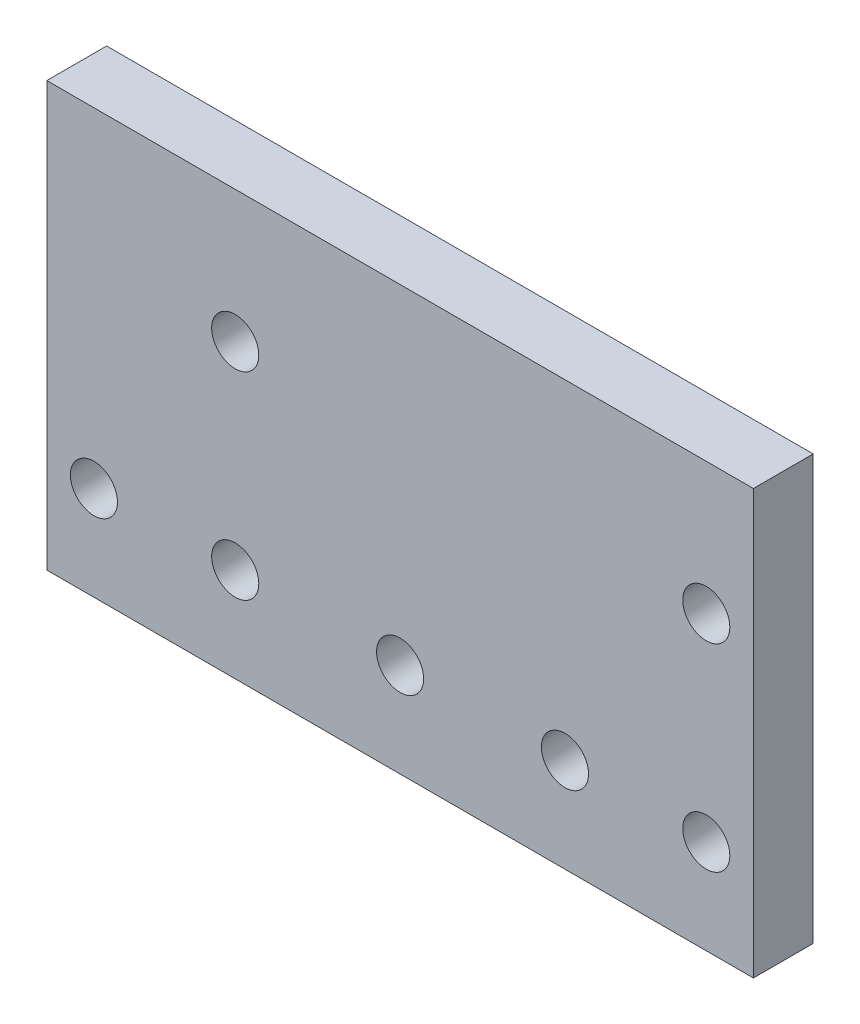
from build123d import *

# Parameters (mm, degrees)
SKETCH1_W           = 75
SKETCH1_H           = 45
SKETCH1_R           = 2.5
BOSS_EXTRUDE1_DEPTH = 6.35


with BuildPart() as part:
    # Sketch1 → Boss-Extrude1 (new body)
    with BuildSketch(Plane.XY):
        with Locations((37.5, 22.5)):
            Rectangle(SKETCH1_W, SKETCH1_H)
        with Locations((20, 31)):
            Circle(SKETCH1_R, mode=Mode.SUBTRACT)
        with Locations((70, 31)):
            Circle(SKETCH1_R, mode=Mode.SUBTRACT)
        with Locations((5, 10)):
            Circle(SKETCH1_R, mode=Mode.SUBTRACT)
        with Locations((20, 10)):
            Circle(SKETCH1_R, mode=Mode.SUBTRACT)
        with Locations((55, 10)):
            Circle(SKETCH1_R, mode=Mode.SUBTRACT)
        with Locations((70, 10)):
            Circle(SKETCH1_R, mode=Mode.SUBTRACT)
        with Locations((37.5, 10)):
            Circle(SKETCH1_R, mode=Mode.SUBTRACT)
    extrude(amount=BOSS_EXTRUDE1_DEPTH)


solid = part.part
